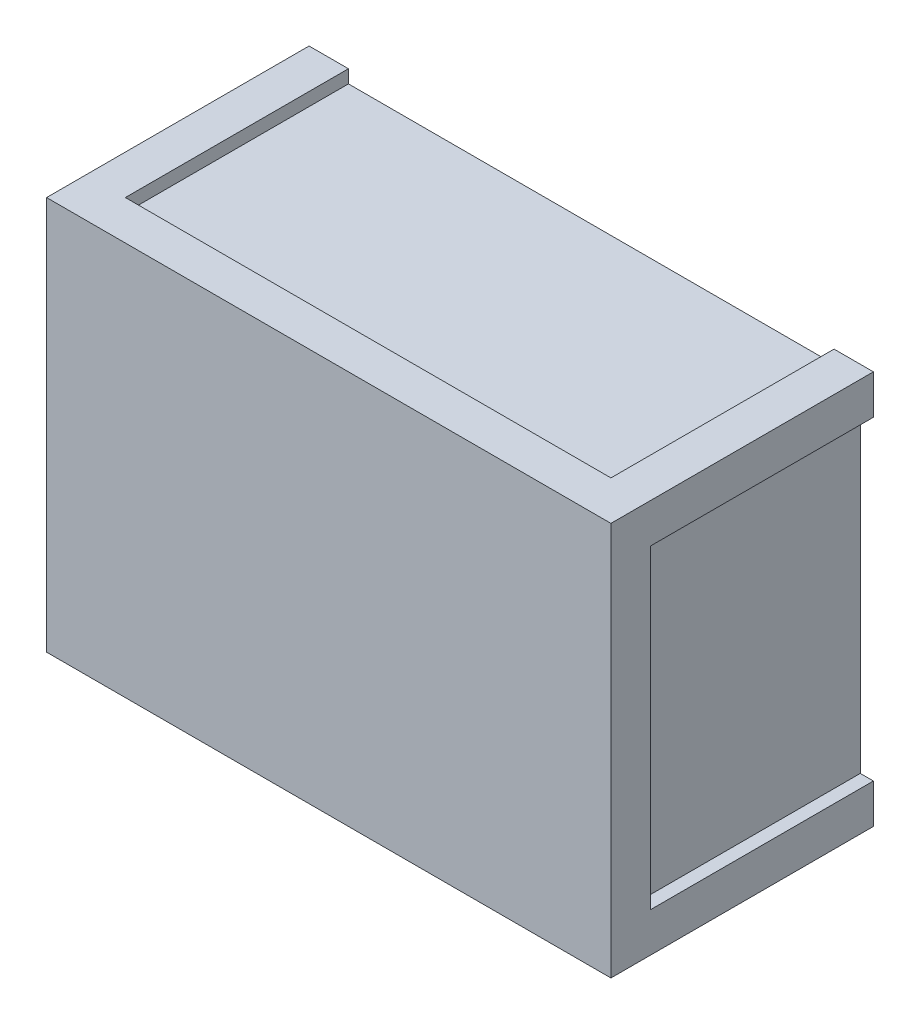
from build123d import *

# Parameters (mm, degrees)
SKETCH1_W               = 4500
SKETCH1_H               = 3200
SKETCH1_W_2             = 4300
SKETCH1_H_2             = 3000
BOSS_EXTRUDE1_DEPTH     = 2000
CUT_EXTRUDE1_DEPTH      = 5819.93461039
CUT_EXTRUDE1_DEPTH_BACK = 5819.93461039
SKETCH2_W               = 3700
SKETCH2_H               = 1700
CUT_EXTRUDE2_DEPTH      = 5873.81874401
CUT_EXTRUDE2_DEPTH_BACK = 5873.81874401
SKETCH3_W               = 1700
SKETCH3_H               = 2400
SKETCH4_W               = 3700
SKETCH4_H               = 200
BOSS_EXTRUDE2_DEPTH     = 1700
SKETCH4_W_2             = 200
SKETCH4_H_2             = 2400
BOSS_EXTRUDE2_2_DEPTH   = 1700
BOSS_EXTRUDE2_3_DEPTH   = 1700
BOSS_EXTRUDE2_4_DEPTH   = 1700
SKETCH5_W               = 4300
SKETCH5_H               = 3000
BOSS_EXTRUDE3_DEPTH     = 2000


with BuildPart() as part:
    # Sketch1 → Boss-Extrude1 (new body)
    with BuildSketch(Plane.XY):
        with Locations((2250, 1600)):
            Rectangle(SKETCH1_W, SKETCH1_H)
        with Locations((2250, 1600)):
            Rectangle(SKETCH1_W_2, SKETCH1_H_2, mode=Mode.SUBTRACT)
    extrude(amount=BOSS_EXTRUDE1_DEPTH)

    # Sketch2 → Cut-Extrude1 (cut, two sides: drawn at the far end of the back side and taken through both)
    with BuildSketch(Plane.XZ.offset(-3100).offset(-CUT_EXTRUDE1_DEPTH_BACK)):
        with Locations((2250, 850)):
            Rectangle(SKETCH2_W, SKETCH2_H)
    extrude(amount=CUT_EXTRUDE1_DEPTH + CUT_EXTRUDE1_DEPTH_BACK, mode=Mode.SUBTRACT)

    # Sketch3 → Cut-Extrude2 (cut, two sides: drawn at the far end of the back side and taken through both)
    with BuildSketch(Plane.ZY.offset(-CUT_EXTRUDE2_DEPTH_BACK)):
        with Locations((850, 1600)):
            Rectangle(SKETCH3_W, SKETCH3_H)
    extrude(amount=CUT_EXTRUDE2_DEPTH + CUT_EXTRUDE2_DEPTH_BACK, mode=Mode.SUBTRACT)


with BuildPart() as body_2:
    # Sketch4 → Boss-Extrude2 (new body)
    with BuildSketch(Plane(origin=(0, 0, 1700), x_dir=(-1, 0, 0), z_dir=(0, 0, -1))):
        with Locations((-2250, 100)):
            Rectangle(SKETCH4_W, SKETCH4_H)
    extrude(amount=BOSS_EXTRUDE2_DEPTH)


with BuildPart() as body_3:
    # Sketch4 → Boss-Extrude2 2 (new body)
    with BuildSketch(Plane(origin=(0, 0, 1700), x_dir=(-1, 0, 0), z_dir=(0, 0, -1))):
        with Locations((-100, 1600)):
            Rectangle(SKETCH4_W_2, SKETCH4_H_2)
    extrude(amount=BOSS_EXTRUDE2_2_DEPTH)


with BuildPart() as body_4:
    # Sketch4 → Boss-Extrude2 3 (new body)
    with BuildSketch(Plane(origin=(0, 0, 1700), x_dir=(-1, 0, 0), z_dir=(0, 0, -1))):
        with Locations((-2250, 3100)):
            Rectangle(SKETCH4_W, SKETCH4_H)
    extrude(amount=BOSS_EXTRUDE2_3_DEPTH)


with BuildPart() as body_5:
    # Sketch4 → Boss-Extrude2 4 (new body)
    with BuildSketch(Plane(origin=(0, 0, 1700), x_dir=(-1, 0, 0), z_dir=(0, 0, -1))):
        with Locations((-4400, 1600)):
            Rectangle(SKETCH4_W_2, SKETCH4_H_2)
    extrude(amount=BOSS_EXTRUDE2_4_DEPTH)


with BuildPart() as body_6:
    # Sketch5 → Boss-Extrude3 (new body)
    with BuildSketch(Plane.XY.offset(2000)):
        with Locations((2250, 1600)):
            Rectangle(SKETCH5_W, SKETCH5_H)
    extrude(amount=-BOSS_EXTRUDE3_DEPTH)

    # Combine1: cut part, body 5, body 4, body 3, body 2
    add(part.part, mode=Mode.SUBTRACT)
    add(body_5.part, mode=Mode.SUBTRACT)
    add(body_4.part, mode=Mode.SUBTRACT)
    add(body_3.part, mode=Mode.SUBTRACT)
    add(body_2.part, mode=Mode.SUBTRACT)


solid = body_6.part
